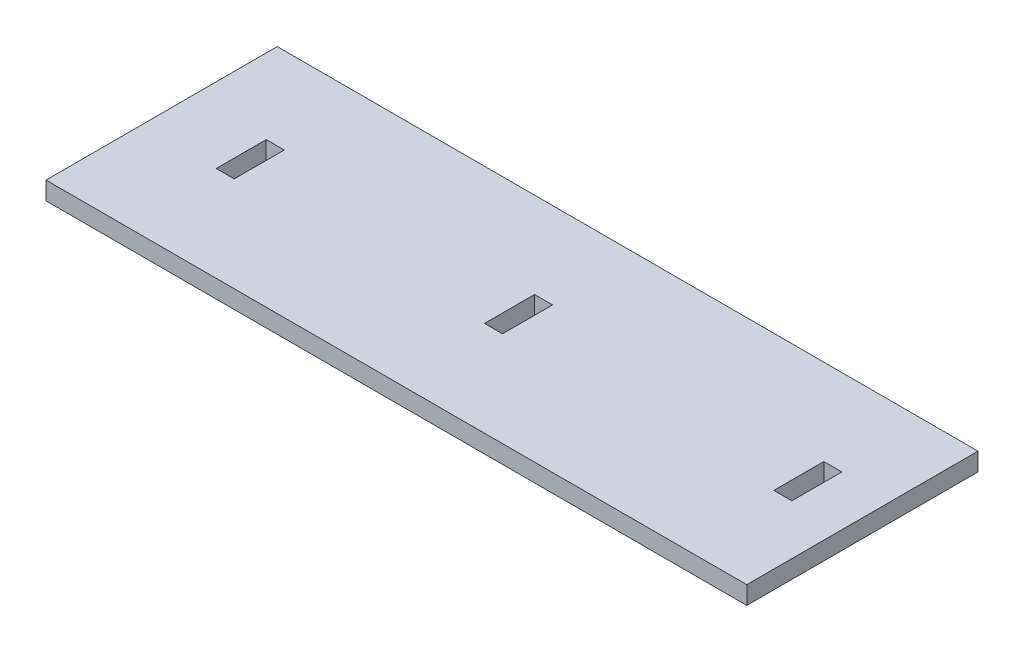
from build123d import *

# Parameters (mm, degrees)
SKETCH1_W           = 177.8
SKETCH1_H           = 58.674
SKETCH1_W_2         = 4.572
SKETCH1_H_2         = 12.7
BOSS_EXTRUDE1_DEPTH = 4.572


with BuildPart() as part:
    # Sketch1 → Boss-Extrude1 (new body)
    with BuildSketch(Plane(origin=(0, 0, 0), x_dir=(1, 0, 0), z_dir=(0, 1, 0))):
        with Locations((88.9, 29.337)):
            Rectangle(SKETCH1_W, SKETCH1_H)
        with Locations((21.336, 30.48)):
            Rectangle(SKETCH1_W_2, SKETCH1_H_2, mode=Mode.SUBTRACT)
        with Locations((89.408, 30.48)):
            Rectangle(SKETCH1_W_2, SKETCH1_H_2, mode=Mode.SUBTRACT)
        with Locations((162.814, 30.48)):
            Rectangle(SKETCH1_W_2, SKETCH1_H_2, mode=Mode.SUBTRACT)
    extrude(amount=BOSS_EXTRUDE1_DEPTH)


solid = part.part
